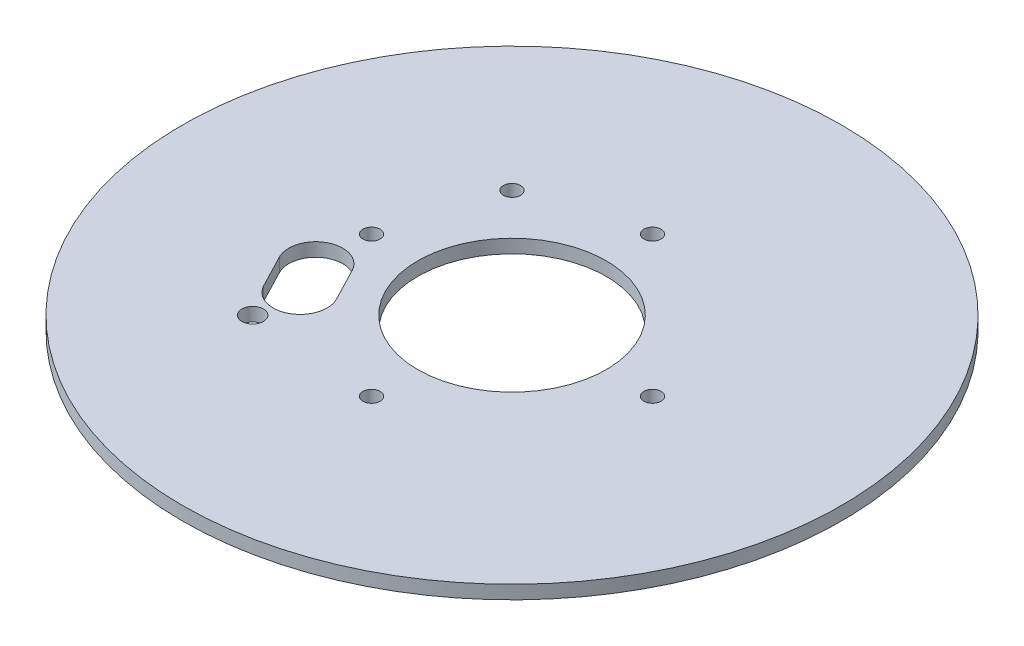
from build123d import *

# Parameters (mm, degrees)
SKETCH1_R           = 77.4600051
BOSS_EXTRUDE1_DEPTH = 3.175
SKETCH24_R          = 22.1615
SKETCH24_R_2        = 2.0193
SKETCH24_R_3        = 2.54
CUT_EXTRUDE14_DEPTH = 110.590991442


with BuildPart() as part:
    # Sketch1 → Boss-Extrude1 (new body)
    with BuildSketch(Plane(origin=(0, 0, 0), x_dir=(1, 0, 0), z_dir=(0, 1, 0))):
        with Locations(Location((0, 0, 0), (0, 0, 270))):
            Circle(SKETCH1_R)
    extrude(amount=BOSS_EXTRUDE1_DEPTH)

    # Sketch24 → Cut-Extrude14 (cut, through all)
    with BuildSketch(Plane(origin=(0, 3.175, 0), x_dir=(1, 0, 0), z_dir=(0, 1, 0))):
        with Locations(Location((0, 0, 0), (0, 0, 270))):
            Circle(SKETCH24_R)
        with Locations(Location((0, 33.02, 0), (0, 0, 270))):
            Circle(SKETCH24_R_2)
        with Locations(Location((33.02, 0, 0), (0, 0, 270))):
            Circle(SKETCH24_R_2)
        with Locations(Location((-33.02, 0, 0), (0, 0, 270))):
            Circle(SKETCH24_R_2)
        with Locations(Location((0, -33.02, 0), (0, 0, 270))):
            Circle(SKETCH24_R_2)
        with Locations(Location((-30.48, -30.48, 0), (0, 0, 270))):
            Circle(SKETCH24_R_3)
        with Locations(Location((-25.4, 25.4, 0), (0, 0, 270))):
            Circle(SKETCH24_R_2)
        with BuildLine():
            Line((-27.903416949, -9.657564215), (-23.915755925, -17.31778977))
            ThreePointArc((-23.915755925, -17.31778977), (-26.616171022, -25.882412255), (-35.180793507, -23.181997158))
            Line((-35.180793507, -23.181997158), (-39.16845453, -15.521771603))
            ThreePointArc((-39.16845453, -15.521771603), (-36.468039434, -6.957149118), (-27.903416949, -9.657564215))
        make_face()
    extrude(amount=-CUT_EXTRUDE14_DEPTH, mode=Mode.SUBTRACT)


solid = part.part
